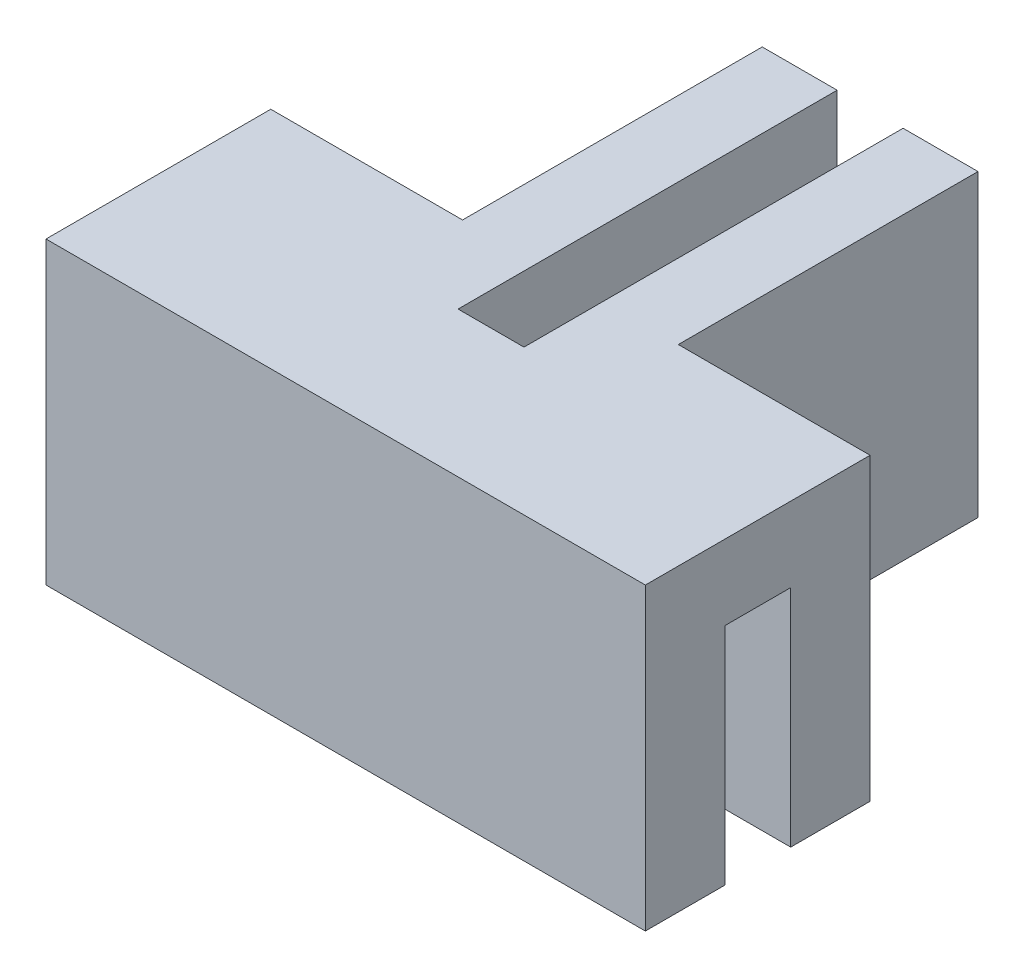
from build123d import *

# Parameters (mm, degrees)
BOSS_EXTRUDE1_DEPTH = 12.7
SKETCH3_W           = 25.4
SKETCH3_H           = 2.794
CUT_EXTRUDE1_DEPTH  = 9.525


with BuildPart() as part:
    # Sketch2 → Boss-Extrude1 (new body)
    with BuildSketch(Plane(origin=(0, 0, 0), x_dir=(1, 0, 0), z_dir=(0, 1, 0))):
        Polygon((-4.572, 0), (-12.7, 0), (-12.7, -9.525), (12.7, -9.525), (12.7, 0), (4.572, 0), (4.572, 12.7), (1.397, 12.7), (1.397, -3.3655), (-1.397, -3.3655), (-1.397, 12.7), (-4.572, 12.7), align=None)
    extrude(amount=BOSS_EXTRUDE1_DEPTH)

    # Sketch3 → Cut-Extrude1 (cut)
    with BuildSketch(Plane.XZ):
        with Locations((0, 4.7625)):
            Rectangle(SKETCH3_W, SKETCH3_H)
    extrude(amount=-CUT_EXTRUDE1_DEPTH, mode=Mode.SUBTRACT)


solid = part.part
